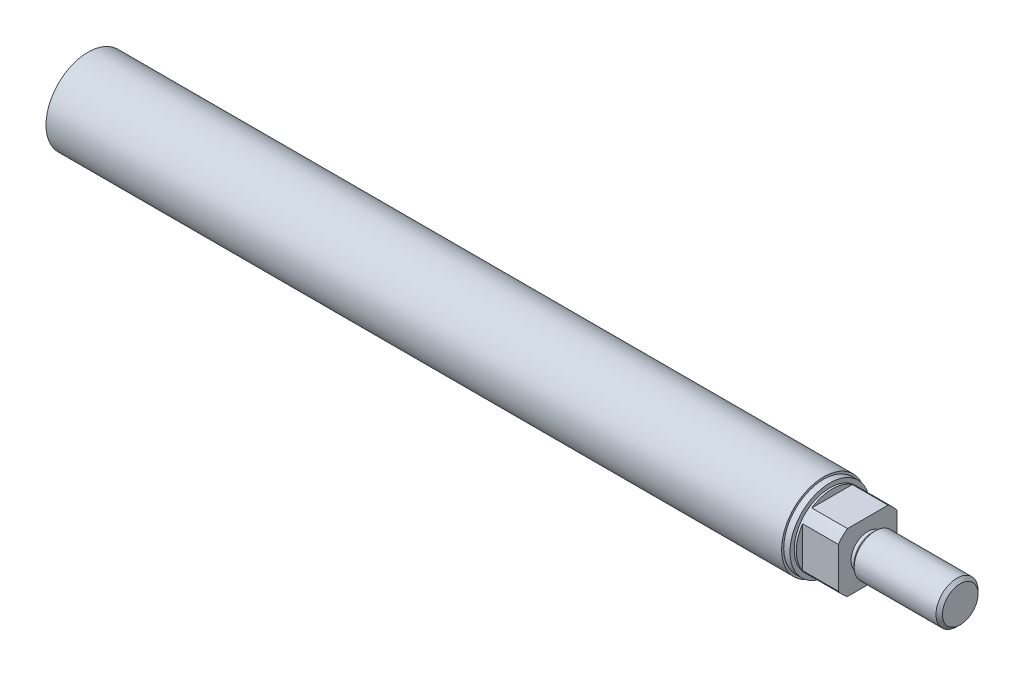
from build123d import *

# Parameters (mm, degrees)
SKETCH2_R          = 11
SKETCH2_W          = 14
SKETCH2_H          = 14
CUT_EXTRUDE1_DEPTH = 8.5


with BuildPart() as part:
    # Sketch1 → Revolve1 (revolve)
    with BuildSketch(Plane.XY, mode=Mode.PRIVATE) as revolve1_sk:
        Polygon((-165, 0), (-165, 10), (10, 10), (10, 9.5), (11.5, 9.5), (11.5, 8.5), (20.5, 8.5), (20.5, 4), (21.5, 4), (21.5, 4.233), (22.267, 5), (41.733, 5), (42.5, 4.233), (42.5, 0), align=None)
    revolve(revolve1_sk.sketch.rotate(Axis((42.5, 0, 0), (-1, 0, 0)), 270), axis=Axis((42.5, 0, 0), (-1, 0, 0)))

    # Sketch2 → Cut-Extrude1 (cut)
    with BuildSketch(Plane(origin=(20.5, 0, 0), x_dir=(0, 0, -1), z_dir=(1, 0, 0))):
        Circle(SKETCH2_R)
        Rectangle(SKETCH2_W, SKETCH2_H, mode=Mode.SUBTRACT)
    extrude(amount=-CUT_EXTRUDE1_DEPTH, mode=Mode.SUBTRACT)


solid = part.part
